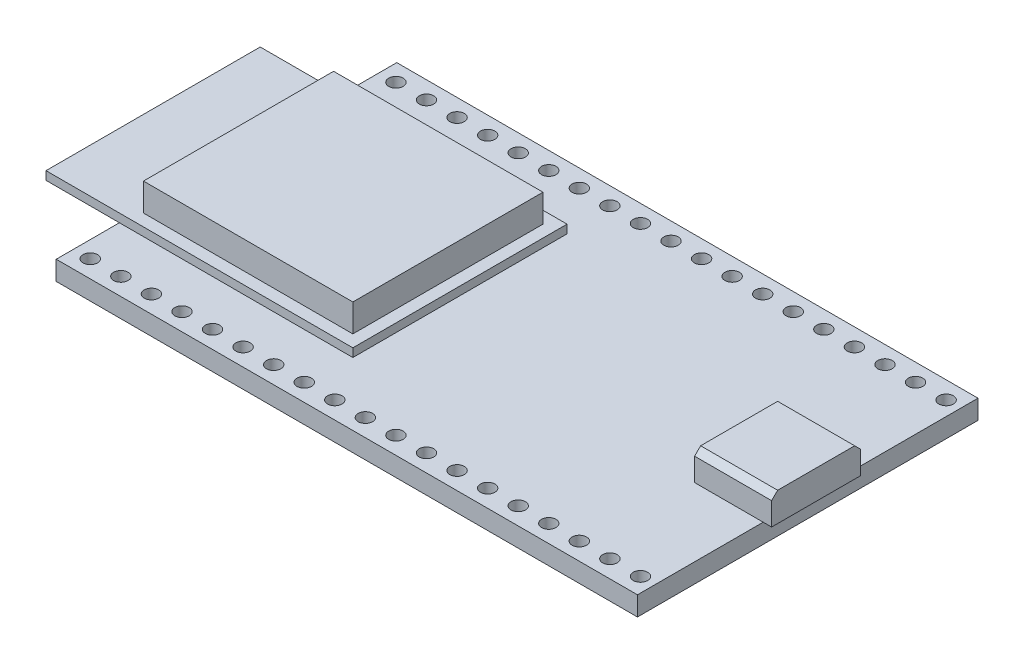
from build123d import *

# Parameters (mm, degrees)
SKETCH_1_W          = 48.3
SKETCH_1_H          = 28.3
EXTRUDE_1_DEPTH     = 1.6
SKETCH_3_W          = 25.5
SKETCH_3_H          = 17.8
EXTRUDE_2_DEPTH     = 0.7
SKETCH_4_W          = 17.4
SKETCH_4_H          = 15.8
EXTRUDE_3_DEPTH     = 2.3
SKETCH_5_W          = 6.4
SKETCH_5_H          = 7.4
EXTRUDE_4_DEPTH     = 2.4
CHAMFER_1_SIZE      = 0.5
SKETCH_6_R          = 0.6
CUT_EXTRUDE_1_DEPTH = 34.530359378


with BuildPart() as part:
    # 草图1 → 凸台-拉伸1 (new body)
    with BuildSketch(Plane(origin=(0, 0, 0), x_dir=(1, 0, 0), z_dir=(0, 1, 0))):
        Rectangle(SKETCH_1_W, SKETCH_1_H)
    extrude(amount=EXTRUDE_1_DEPTH)

    # 草图3 → 凸台-拉伸2 (add)
    with BuildSketch(Plane(origin=(0, 1.6, 0), x_dir=(1, 0, 0), z_dir=(0, 1, 0))):
        with Locations((-17.5, 0)):
            Rectangle(SKETCH_3_W, SKETCH_3_H)
    extrude(amount=EXTRUDE_2_DEPTH)

    # 草图4 → 凸台-拉伸3 (add)
    with BuildSketch(Plane(origin=(0, 2.3, 0), x_dir=(1, 0, 0), z_dir=(0, 1, 0))):
        with Locations((-14.45, 0)):
            Rectangle(SKETCH_4_W, SKETCH_4_H)
    extrude(amount=EXTRUDE_3_DEPTH)

    # 草图5 → 凸台-拉伸4 (add)
    with BuildSketch(Plane(origin=(0, 1.6, 0), x_dir=(1, 0, 0), z_dir=(0, 1, 0))):
        with Locations((21.65, 0)):
            Rectangle(SKETCH_5_W, SKETCH_5_H)
    extrude(amount=EXTRUDE_4_DEPTH)

    # 倒角1
    chamfer_1_edges = [part.edges().sort_by_distance(p)[0] for p in [
        (21.65, 4, -3.7),
        (21.65, 4, 3.7),
    ]]
    chamfer(chamfer_1_edges, length=CHAMFER_1_SIZE)

    # 草图6 → 切除-拉伸1 (cut, through all)
    with BuildSketch(Plane(origin=(0, 1.6, 0), x_dir=(1, 0, 0), z_dir=(0, 1, 0))):
        with Locations(Location((22.95, 12.7, 0), (0, 0, 270))):
            Circle(SKETCH_6_R)
        with Locations(Location((20.41, 12.7, 0), (0, 0, 270))):
            Circle(SKETCH_6_R)
        with Locations(Location((17.87, 12.7, 0), (0, 0, 270))):
            Circle(SKETCH_6_R)
        with Locations(Location((15.33, 12.7, 0), (0, 0, 270))):
            Circle(SKETCH_6_R)
        with Locations(Location((12.79, 12.7, 0), (0, 0, 270))):
            Circle(SKETCH_6_R)
        with Locations(Location((10.25, 12.7, 0), (0, 0, 270))):
            Circle(SKETCH_6_R)
        with Locations(Location((7.71, 12.7, 0), (0, 0, 270))):
            Circle(SKETCH_6_R)
        with Locations(Location((5.17, 12.7, 0), (0, 0, 270))):
            Circle(SKETCH_6_R)
        with Locations(Location((2.63, 12.7, 0), (0, 0, 270))):
            Circle(SKETCH_6_R)
        with Locations(Location((0.09, 12.7, 0), (0, 0, 270))):
            Circle(SKETCH_6_R)
        with Locations(Location((-2.45, 12.7, 0), (0, 0, 270))):
            Circle(SKETCH_6_R)
        with Locations(Location((-4.99, 12.7, 0), (0, 0, 270))):
            Circle(SKETCH_6_R)
        with Locations(Location((-7.53, 12.7, 0), (0, 0, 270))):
            Circle(SKETCH_6_R)
        with Locations(Location((-10.07, 12.7, 0), (0, 0, 270))):
            Circle(SKETCH_6_R)
        with Locations(Location((-12.61, 12.7, 0), (0, 0, 270))):
            Circle(SKETCH_6_R)
        with Locations(Location((-15.15, 12.7, 0), (0, 0, 270))):
            Circle(SKETCH_6_R)
        with Locations(Location((-17.69, 12.7, 0), (0, 0, 270))):
            Circle(SKETCH_6_R)
        with Locations(Location((-20.23, 12.7, 0), (0, 0, 270))):
            Circle(SKETCH_6_R)
        with Locations(Location((-22.77, 12.7, 0), (0, 0, 270))):
            Circle(SKETCH_6_R)
        with Locations(Location((20.41, -12.7, 0), (0, 0, 270))):
            Circle(SKETCH_6_R)
        with Locations(Location((17.87, -12.7, 0), (0, 0, 270))):
            Circle(SKETCH_6_R)
        with Locations(Location((15.33, -12.7, 0), (0, 0, 270))):
            Circle(SKETCH_6_R)
        with Locations(Location((12.79, -12.7, 0), (0, 0, 270))):
            Circle(SKETCH_6_R)
        with Locations(Location((10.25, -12.7, 0), (0, 0, 270))):
            Circle(SKETCH_6_R)
        with Locations(Location((7.71, -12.7, 0), (0, 0, 270))):
            Circle(SKETCH_6_R)
        with Locations(Location((5.17, -12.7, 0), (0, 0, 270))):
            Circle(SKETCH_6_R)
        with Locations(Location((2.63, -12.7, 0), (0, 0, 270))):
            Circle(SKETCH_6_R)
        with Locations(Location((0.09, -12.7, 0), (0, 0, 270))):
            Circle(SKETCH_6_R)
        with Locations(Location((-2.45, -12.7, 0), (0, 0, 270))):
            Circle(SKETCH_6_R)
        with Locations(Location((-4.99, -12.7, 0), (0, 0, 270))):
            Circle(SKETCH_6_R)
        with Locations(Location((-7.53, -12.7, 0), (0, 0, 270))):
            Circle(SKETCH_6_R)
        with Locations(Location((-10.07, -12.7, 0), (0, 0, 270))):
            Circle(SKETCH_6_R)
        with Locations(Location((-12.61, -12.7, 0), (0, 0, 270))):
            Circle(SKETCH_6_R)
        with Locations(Location((-15.15, -12.7, 0), (0, 0, 270))):
            Circle(SKETCH_6_R)
        with Locations(Location((-17.69, -12.7, 0), (0, 0, 270))):
            Circle(SKETCH_6_R)
        with Locations(Location((-20.23, -12.7, 0), (0, 0, 270))):
            Circle(SKETCH_6_R)
        with Locations(Location((-22.77, -12.7, 0), (0, 0, 270))):
            Circle(SKETCH_6_R)
        with Locations(Location((22.95, -12.7, 0), (0, 0, 270))):
            Circle(SKETCH_6_R)
    extrude(amount=-CUT_EXTRUDE_1_DEPTH, mode=Mode.SUBTRACT)


solid = part.part
